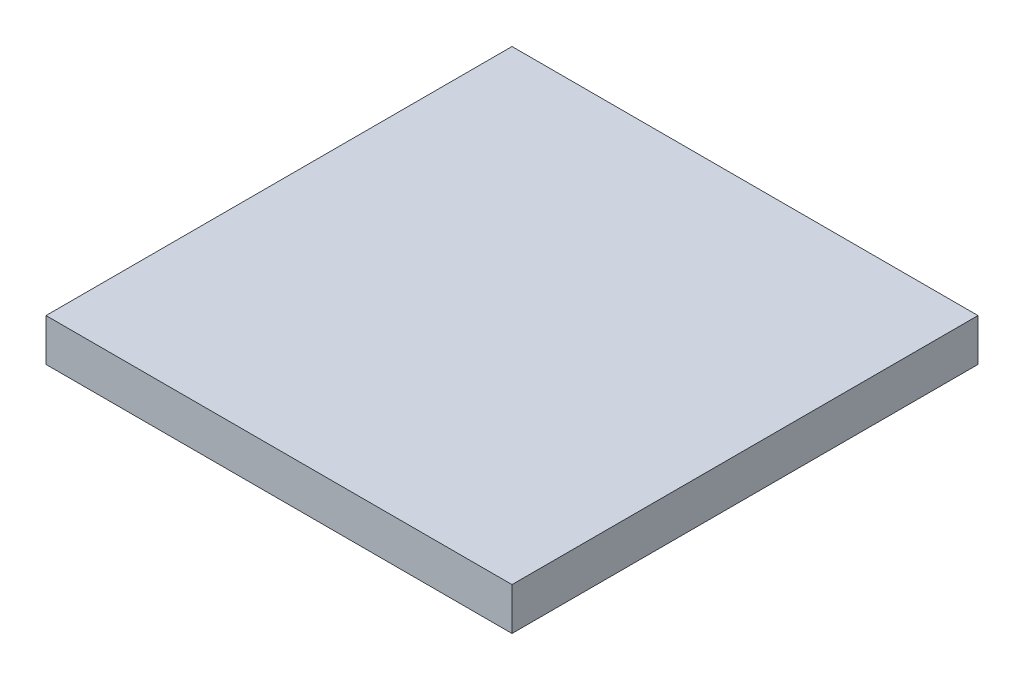
from build123d import *

# Parameters (mm, degrees)
SKETCH1_W           = 550
SKETCH1_H           = 550
BOSS_EXTRUDE1_DEPTH = 50


with BuildPart() as part:
    # Sketch1 → Boss-Extrude1 (new body)
    with BuildSketch(Plane(origin=(0, 0, 0), x_dir=(1, 0, 0), z_dir=(0, 1, 0))):
        Rectangle(SKETCH1_W, SKETCH1_H)
    extrude(amount=-BOSS_EXTRUDE1_DEPTH)


solid = part.part
